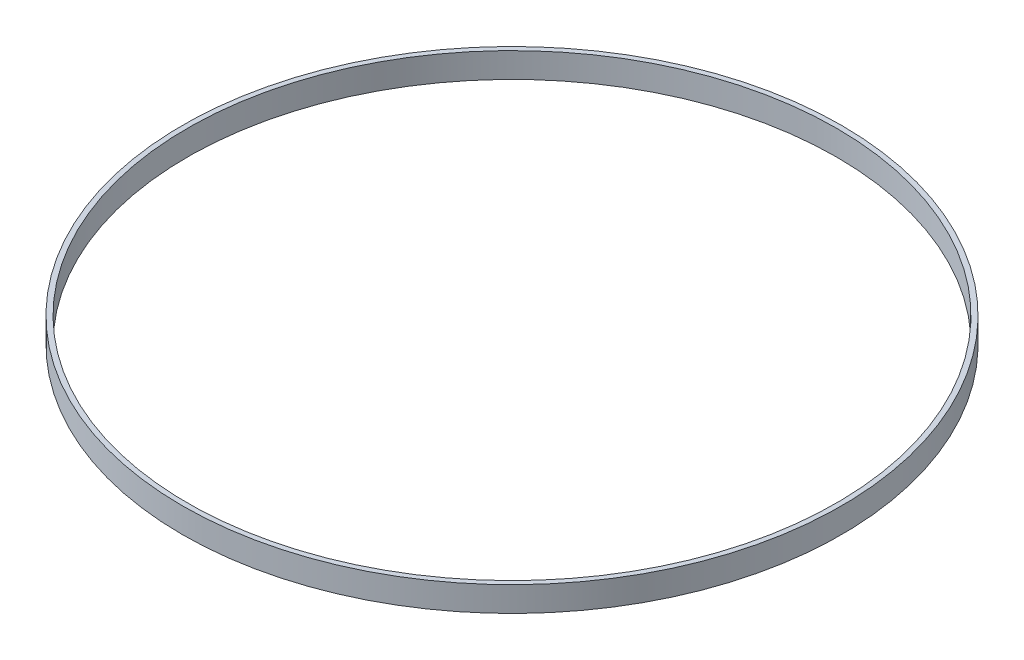
from build123d import *

# Parameters (mm, degrees)
SKETCH1_W = 2
SKETCH1_H = 10


with BuildPart() as part:
    # Sketch1 → Revolve1 (revolve)
    with BuildSketch(Plane.XY, mode=Mode.PRIVATE) as revolve1_sk:
        with Locations((131, 5)):
            Rectangle(SKETCH1_W, SKETCH1_H)
    revolve(revolve1_sk.sketch.rotate(Axis((0, 0, 0), (0, 1, 0)), 90), axis=Axis((0, 0, 0), (0, 1, 0)))


solid = part.part
